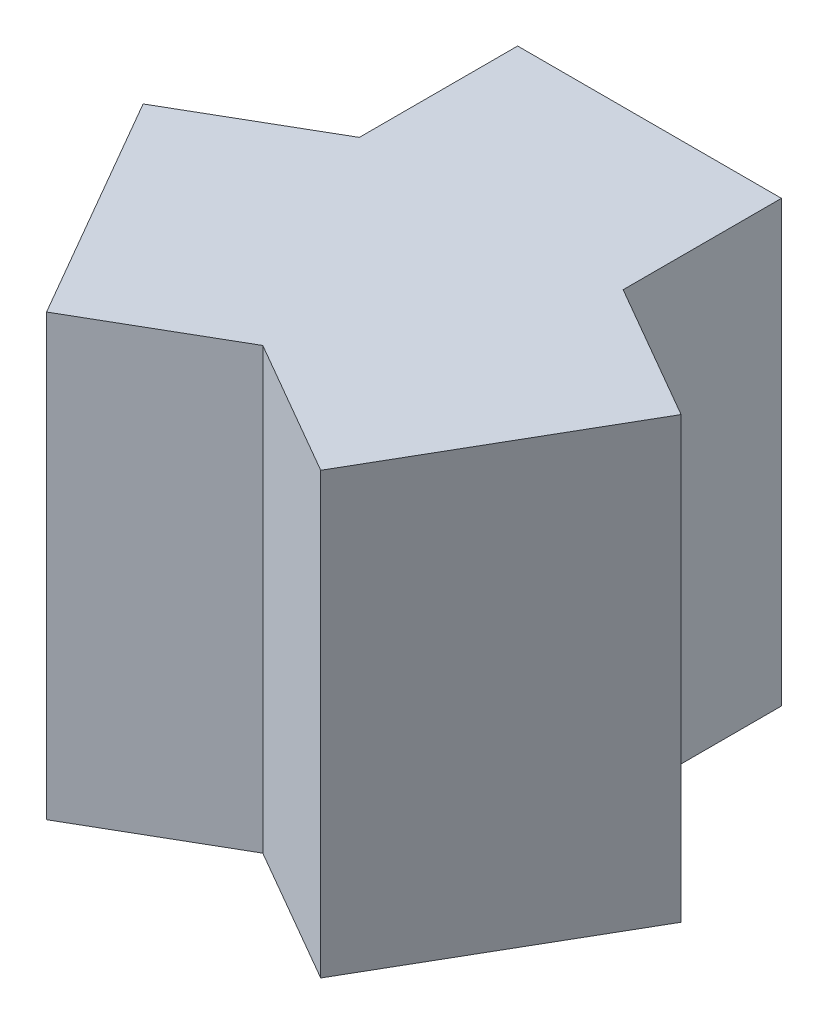
from build123d import *

# Parameters (mm, degrees)
BOSS_EXTRUDE1_DEPTH = 12.5


with BuildPart() as part:
    # Sketch1 → Boss-Extrude1 (new, symmetric)
    with BuildSketch(Plane(origin=(0, 0, 0), x_dir=(1, 0, 0), z_dir=(0, 1, 0))):
        Polygon((15.294228634, 0.5), (7.5, 5), (7.5, 14), (-7.5, 14), (-7.5, 5), (-15.294228634, 0.5), (-7.794228634, -12.490381057), (0, -7.990381057), (7.794228634, -12.490381057), align=None)
    extrude(amount=BOSS_EXTRUDE1_DEPTH, both=True)


solid = part.part
